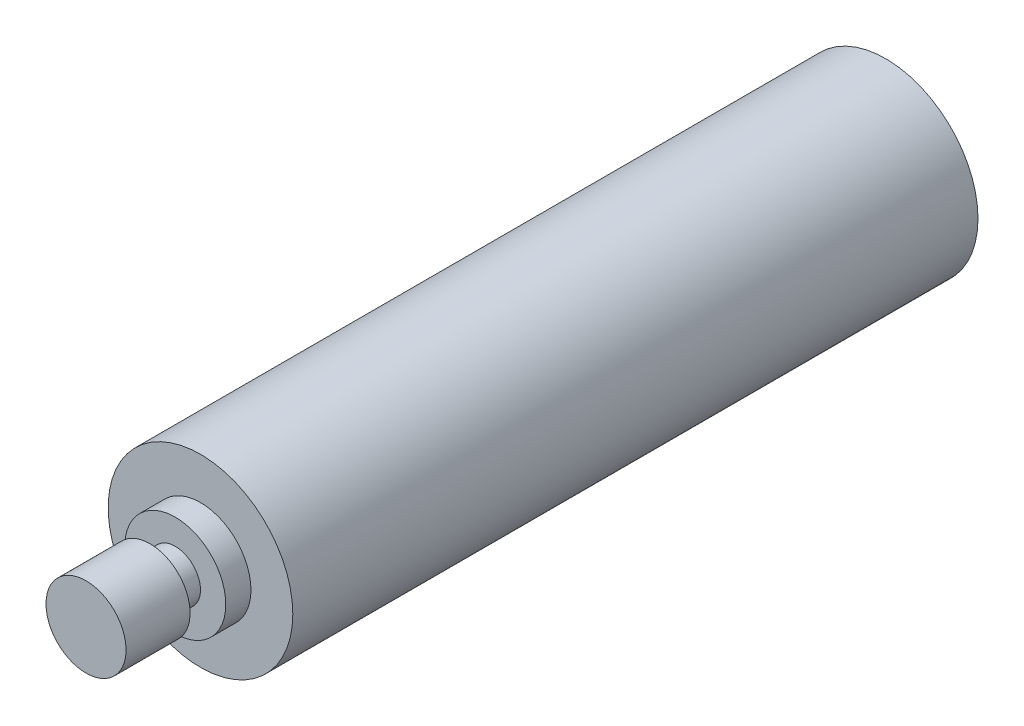
from build123d import *

# Parameters (mm, degrees)
SKETCH1_R           = 10.9855
BOSS_EXTRUDE1_DEPTH = 81.534
SKETCH2_R           = 6.0071
BOSS_EXTRUDE2_DEPTH = 3
SKETCH3_R           = 2.9972
BOSS_EXTRUDE3_DEPTH = 3
SKETCH4_R           = 4.7625
BOSS_EXTRUDE4_DEPTH = 7.62


with BuildPart() as part:
    # Sketch1 → Boss-Extrude1 (new body)
    with BuildSketch(Plane.XY):
        Circle(SKETCH1_R)
    extrude(amount=BOSS_EXTRUDE1_DEPTH)

    # Sketch2 → Boss-Extrude2 (add)
    with BuildSketch(Plane.XY.offset(81.534)):
        Circle(SKETCH2_R)
    extrude(amount=BOSS_EXTRUDE2_DEPTH)

    # Sketch3 → Boss-Extrude3 (add)
    with BuildSketch(Plane.XY.offset(84.534)):
        Circle(SKETCH3_R)
    extrude(amount=BOSS_EXTRUDE3_DEPTH)

    # Sketch4 → Boss-Extrude4 (add)
    with BuildSketch(Plane.XY.offset(87.534)):
        with Locations(Location((0, 0, 0), (0, 0, 180))):
            Circle(SKETCH4_R)
    extrude(amount=BOSS_EXTRUDE4_DEPTH)


solid = part.part
